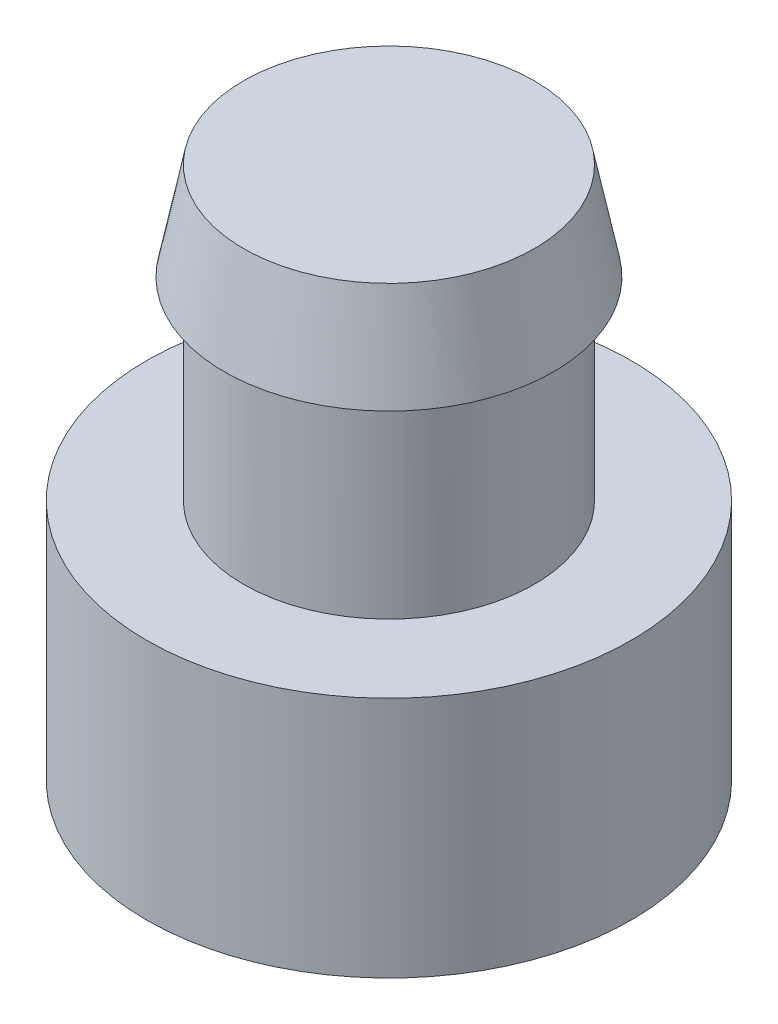
from build123d import *

# Parameters (mm, degrees)
SKETCH1_R           = 2.5
BOSS_EXTRUDE1_DEPTH = 2.5
SKETCH2_R           = 1.5
BOSS_EXTRUDE2_DEPTH = 3


with BuildPart() as part:
    # Sketch1 → Boss-Extrude1 (new body)
    with BuildSketch(Plane(origin=(0, 0, 0), x_dir=(1, 0, 0), z_dir=(0, 1, 0))):
        with Locations(Location((0, 0, 0), (0, 0, 270))):
            Circle(SKETCH1_R)
    extrude(amount=BOSS_EXTRUDE1_DEPTH)

    # Sketch2 → Boss-Extrude2 (add)
    with BuildSketch(Plane(origin=(0, 2.5, 0), x_dir=(1, 0, 0), z_dir=(0, 1, 0))):
        with Locations(Location((0, 0, 0), (0, 0, 270))):
            Circle(SKETCH2_R)
    extrude(amount=BOSS_EXTRUDE2_DEPTH)

    # Sketch3 → Revolve1 (revolve)
    with BuildSketch(Plane.XY, mode=Mode.PRIVATE) as revolve1_sk:
        Polygon((1.5, 5.5), (1.5, 4.5), (1.7, 4.5), align=None)
    revolve(revolve1_sk.sketch.rotate(Axis((0, 0, 0), (0, 1, 0)), 90), axis=Axis((0, 0, 0), (0, 1, 0)))


solid = part.part
